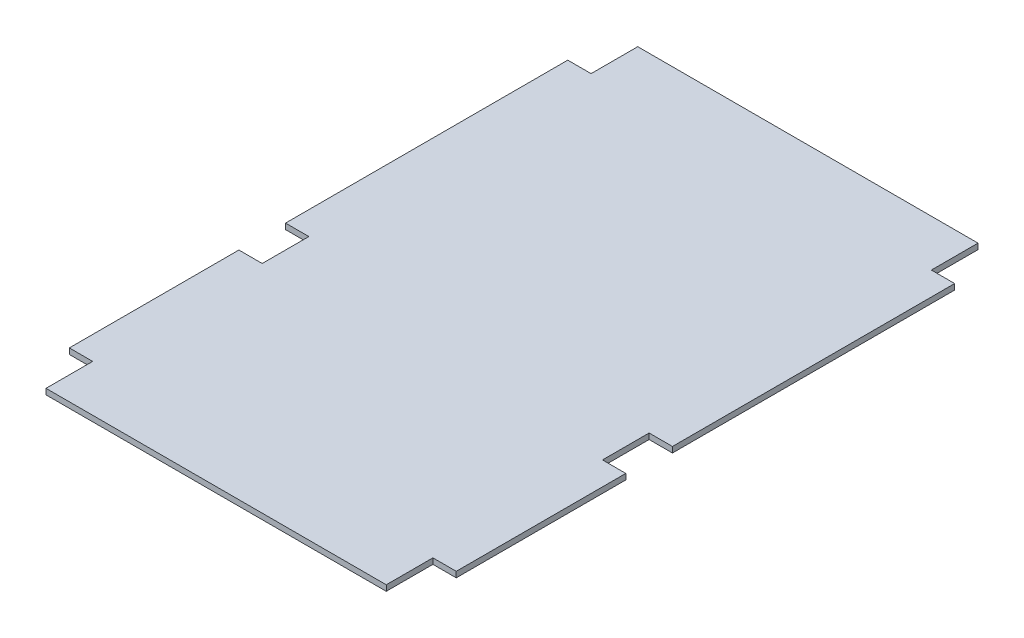
from build123d import *

# Parameters (mm, degrees)
SKETCH_1_W          = 340
SKETCH_1_H          = 520
EXTRUDE_1_DEPTH     = 5
SKETCH_2_W          = 20.5
SKETCH_2_H          = 41
CUT_EXTRUDE_1_DEPTH = 622.309101816
SKETCH_3_W          = 20.5
SKETCH_3_H          = 41
CUT_EXTRUDE_2_DEPTH = 15


with BuildPart() as part:
    # 스케치1 → 보스-돌출1 (new body)
    with BuildSketch(Plane(origin=(0, 0, 0), x_dir=(1, 0, 0), z_dir=(0, 1, 0))):
        with Locations((170, 260)):
            Rectangle(SKETCH_1_W, SKETCH_1_H)
    extrude(amount=EXTRUDE_1_DEPTH)

    # 스케치2 → 컷-돌출1 (cut, through all)
    with BuildSketch(Plane(origin=(0, 5, 0), x_dir=(1, 0, 0), z_dir=(0, 1, 0))):
        with Locations((329.75, 499.5)):
            Rectangle(SKETCH_2_W, SKETCH_2_H)
        with Locations((329.75, 20.5)):
            Rectangle(SKETCH_2_W, SKETCH_2_H)
        with Locations((10.25, 20.5)):
            Rectangle(SKETCH_2_W, SKETCH_2_H)
        with Locations((10.25, 499.5)):
            Rectangle(SKETCH_2_W, SKETCH_2_H)
    extrude(amount=-CUT_EXTRUDE_1_DEPTH, mode=Mode.SUBTRACT)

    # 스케치3 → 컷-돌출2 (cut)
    with BuildSketch(Plane(origin=(0, 5, 0), x_dir=(1, 0, 0), z_dir=(0, 1, 0))):
        with Locations((329.75, 210.5)):
            Rectangle(SKETCH_3_W, SKETCH_3_H)
        with Locations((10.25, 210.5)):
            Rectangle(SKETCH_3_W, SKETCH_3_H)
    extrude(amount=-CUT_EXTRUDE_2_DEPTH, mode=Mode.SUBTRACT)


solid = part.part
